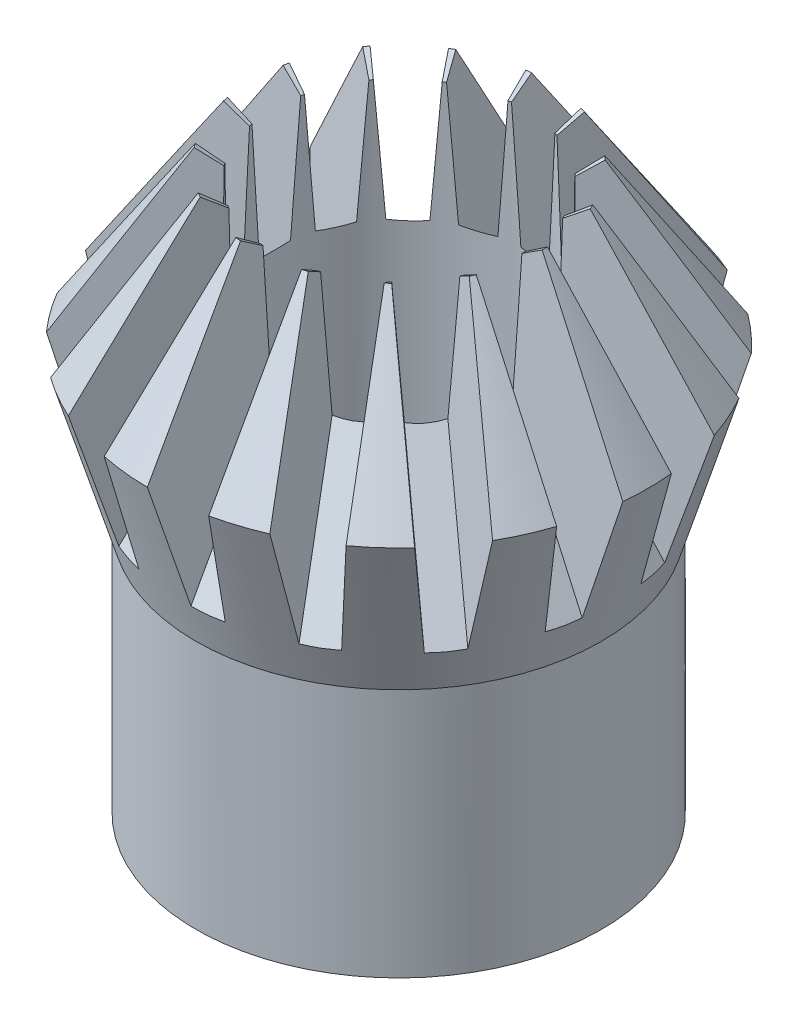
from build123d import *

# Parameters (mm, degrees)
CUT_EXTRUDE_START        = -8.494493
CUT_EXTRUDE_2_DEPTH      = 8.541722
PATTERN_CIRCULAR_1_COUNT = 15
CUT_EXTRUDE_3_REACH      = 23.26
CUT_EXTRUDE_3_END_RADIUS = 6.5
SKETCH_5_R               = 2


with BuildPart() as part:
    # 草图2 → 旋转1 (revolve)
    with BuildSketch(Plane(origin=(0, 0, 0), x_dir=(0, 0, -1), z_dir=(1, 0, 0))):
        Polygon((4, 0), (6.5, 0), (6.5, 8), (8, 13), (4.68337521, 18), (4, 17.546700168), align=None)
    revolve(axis=Axis((0, 0, 0), (0, 1, 0)))

    # 草图4 → 切除-拉伸2 (cut)
    with BuildSketch(Plane(origin=(6.860530662, 10.342639122, 0), x_dir=(0.8333333333333319, -0.5527707983925689, 0), z_dir=(0.5527707983925689, 0.8333333333333319, 0)).offset(CUT_EXTRUDE_START)):
        Polygon((-10.852687046, -0.5), (-10.852687046, 0.5), (-13.852687046, 0.9), (-13.852687046, -0.9), align=None)
    cut_extrude_2 = extrude(amount=CUT_EXTRUDE_2_DEPTH, mode=Mode.SUBTRACT)

    # 阵列(圆周)1: 切除-拉伸2 ×15 about axis
    pattern_circular_1_axis = Axis((0, 0, 0), (0, 1, 0))
    for i in range(1, PATTERN_CIRCULAR_1_COUNT):
        add(cut_extrude_2.rotate(pattern_circular_1_axis, i * 360 / PATTERN_CIRCULAR_1_COUNT), mode=Mode.SUBTRACT)

    # 切除-拉伸3: up to this cylinder (the profile starts inside it)
    cut_extrude_3_end = Plane(origin=(0, 4, 0), z_dir=(0, -1, 0)) * Cylinder(CUT_EXTRUDE_3_END_RADIUS, 60.52, mode=Mode.PRIVATE)
    # 草图5 → 切除-拉伸3 (cut, up to the surface)
    with BuildSketch(Plane.XY, mode=Mode.PRIVATE) as cut_extrude_3_sk1:
        with Locations((0, 4)):
            Circle(SKETCH_5_R)
    cut_extrude_3_tool1 = extrude(cut_extrude_3_sk1.sketch, amount=-CUT_EXTRUDE_3_REACH, mode=Mode.PRIVATE) & cut_extrude_3_end
    add(cut_extrude_3_tool1.solids().sort_by_distance((0, 4, 0))[0], mode=Mode.SUBTRACT)


solid = part.part
